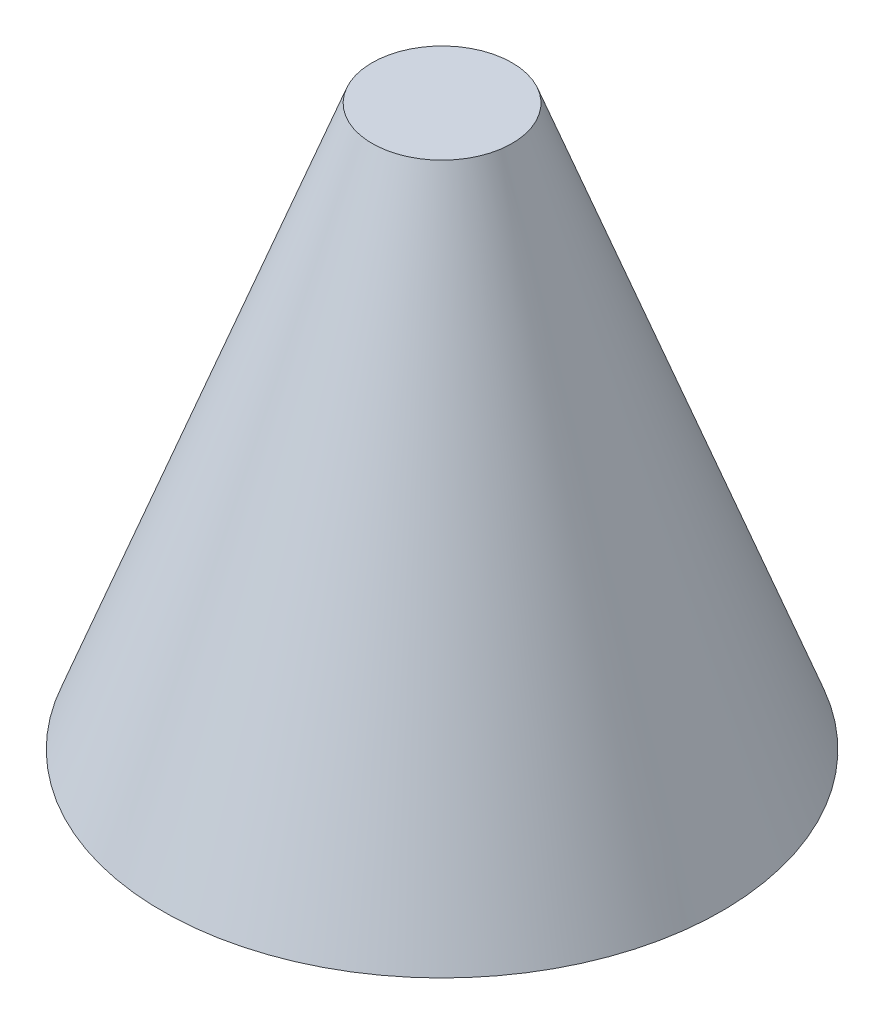
from build123d import *


with BuildPart() as part:
    # Szkic1 → Obrót1 (revolve)
    with BuildSketch(Plane.XY, mode=Mode.PRIVATE) as obr_t1_sk:
        Polygon((0, 0), (-3, 0), (-0.75, 6), (0, 6), align=None)
    revolve(obr_t1_sk.sketch.rotate(Axis((0, 0, 0), (0, 1, 0)), 270), axis=Axis((0, 0, 0), (0, 1, 0)))


solid = part.part
